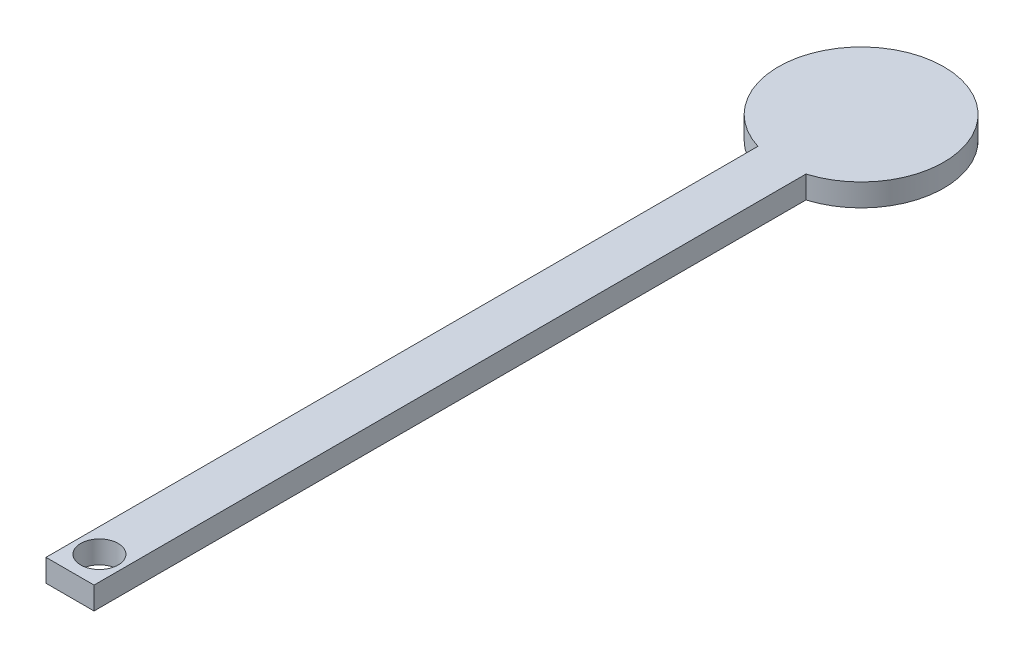
from build123d import *

# Parameters (mm, degrees)
SKETCH2_R           = 5
BOSS_EXTRUDE1_DEPTH = 6
BOSS_EXTRUDE2_START = -14
SKETCH3_R           = 5
BOSS_EXTRUDE2_DEPTH = 14


with BuildPart() as part:
    # Sketch2 → Boss-Extrude1 (new body)
    with BuildSketch(Plane(origin=(0, 0, 0), x_dir=(1, 0, 0), z_dir=(0, 1, 0))):
        with BuildLine():
            Line((13.274432238, 35.765352266), (13.274432238, -125.251116332))
            Line((13.274432238, -125.251116332), (13.274432238, -154.229901261))
            Line((13.274432238, -154.229901261), (0.452829748, -154.229901261))
            Line((0.452829748, -154.229901261), (0.452829748, -125.251116332))
            Line((0.452829748, -125.251116332), (0.452829748, 35.765352266))
            ThreePointArc((0.452829748, 35.765352266), (6.863630993, 78.970129688), (13.274432238, 35.765352266))
        make_face()
        with Locations(Location((6.863630993, 56.892117967, 0), (0, 0, 90))):
            Circle(SKETCH2_R, mode=Mode.SUBTRACT)
        with Locations(Location((6.863630993, -146.377882033, 0), (0, 0, 270))):
            Circle(SKETCH2_R, mode=Mode.SUBTRACT)
    extrude(amount=BOSS_EXTRUDE1_DEPTH)

    # Sketch3 → Boss-Extrude2 (add)
    with BuildSketch(Plane(origin=(0, 6, 0), x_dir=(1, 0, 0), z_dir=(0, 1, 0)).offset(BOSS_EXTRUDE2_START)):
        with Locations(Location((6.863630993, 56.892117967, 0), (0, 0, 270))):
            Circle(SKETCH3_R)
    extrude(amount=BOSS_EXTRUDE2_DEPTH)


solid = part.part
